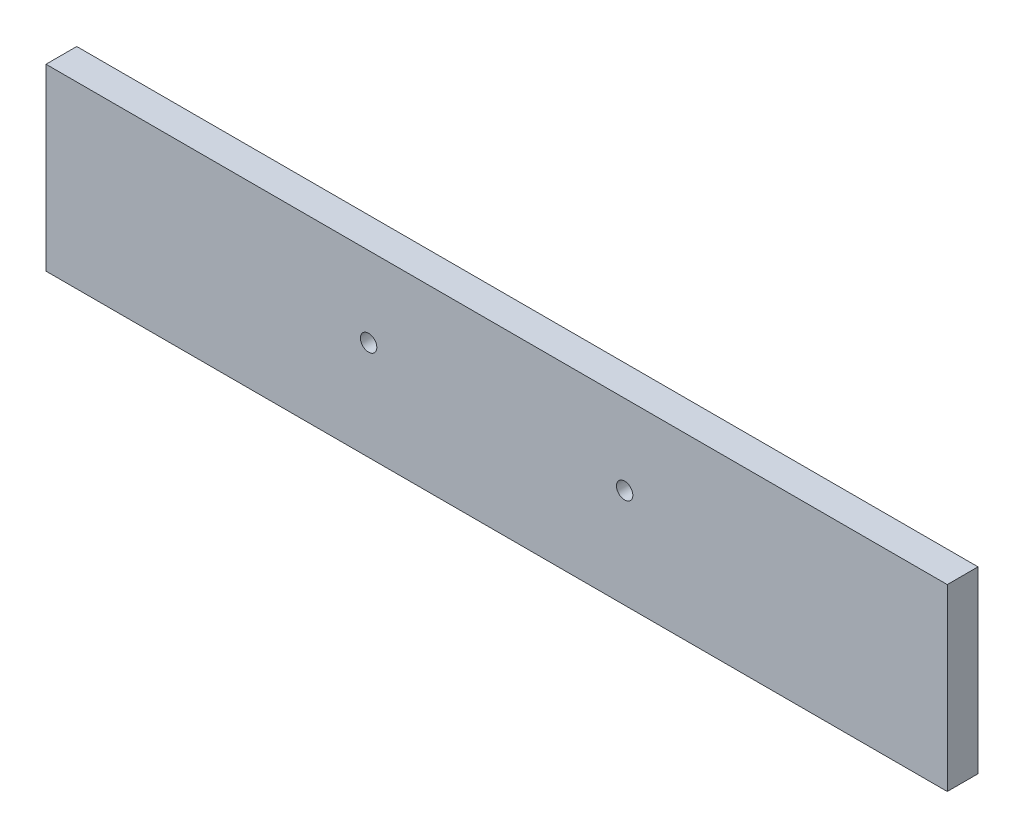
from build123d import *

# Parameters (mm, degrees)
SKETCH1_W           = 176
SKETCH1_H           = 35
SKETCH1_R           = 1.6
BOSS_EXTRUDE1_DEPTH = 6


with BuildPart() as part:
    # Sketch1 → Boss-Extrude1 (new body)
    with BuildSketch(Plane.XY):
        Rectangle(SKETCH1_W, SKETCH1_H)
        with Locations((-25, 1.9)):
            Circle(SKETCH1_R, mode=Mode.SUBTRACT)
        with Locations(Location((25, 1.9, 0), (0, 0, 180))):
            Circle(SKETCH1_R, mode=Mode.SUBTRACT)
    extrude(amount=BOSS_EXTRUDE1_DEPTH)


solid = part.part
